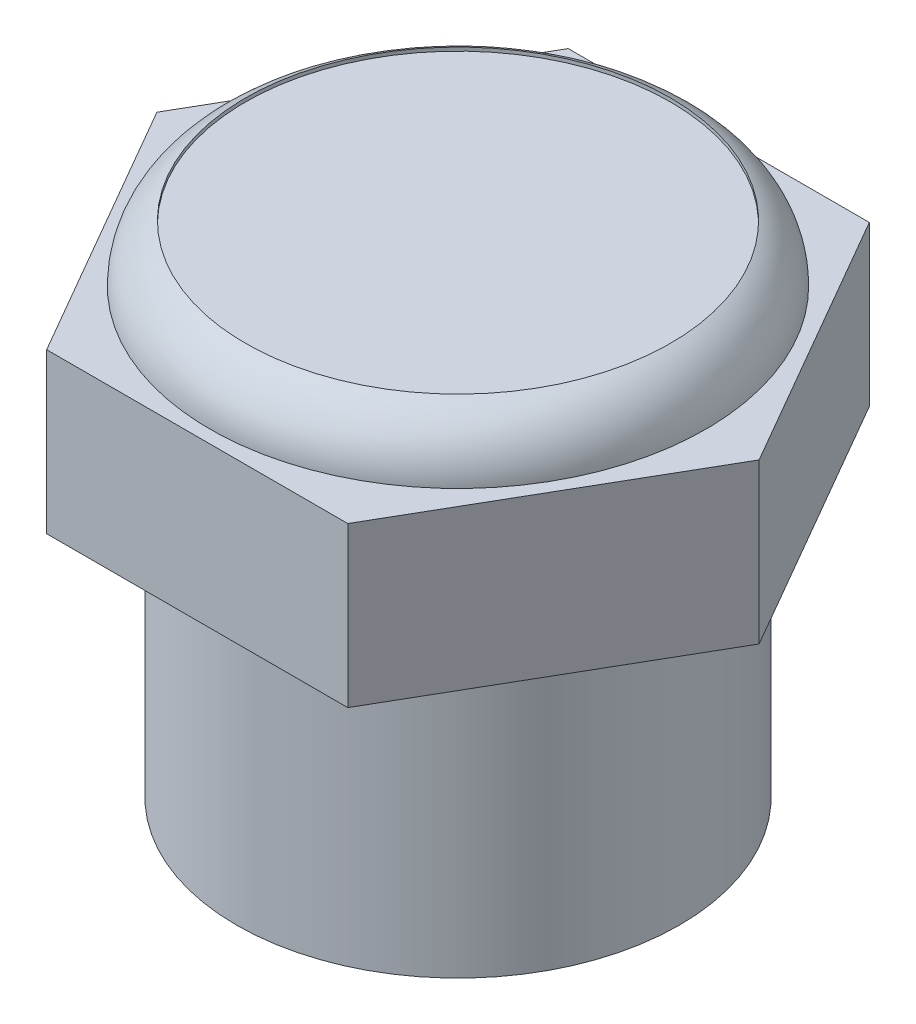
from build123d import *

# Parameters (mm, degrees)
SKETCH_1_R      = 6.25
SKETCH_1_R_2    = 4.5
EXTRUDE_1_DEPTH = 8
EXTRUDE_2_DEPTH = 4.5


with BuildPart() as part:
    # 草图1 → 凸台-拉伸1 (new body)
    with BuildSketch(Plane(origin=(0, 0, 0), x_dir=(1, 0, 0), z_dir=(0, 1, 0))):
        with Locations(Location((0, 0, 0), (0, 0, 270))):
            Circle(SKETCH_1_R)
        with Locations(Location((0, 0, 0), (0, 0, 270))):
            Circle(SKETCH_1_R_2, mode=Mode.SUBTRACT)
    extrude(amount=EXTRUDE_1_DEPTH)

    # 草图2 → 凸台-拉伸2 (add)
    with BuildSketch(Plane(origin=(0, 8, 0), x_dir=(1, 0, 0), z_dir=(0, 1, 0))):
        Polygon((4.25, 7.361215932), (-4.25, 7.361215932), (-8.5, 0), (-4.25, -7.361215932), (4.25, -7.361215932), (8.5, 0), align=None)
    extrude(amount=EXTRUDE_2_DEPTH)

    # 草图3 → 旋转1 (revolve)
    with BuildSketch(Plane.XY, mode=Mode.PRIVATE) as revolve_1_sk:
        with BuildLine():
            ThreePointArc((6, 14.1), (6.729436981, 13.443398113), (7, 12.5))
            Line((7, 12.5), (0, 12.5))
            Line((0, 12.5), (0, 14))
            Line((0, 14), (6, 14))
            Line((6, 14), (6, 14.1))
        make_face()
    revolve(revolve_1_sk.sketch.rotate(Axis((0, -20.81110882, 0), (0, 1, 0)), 90), axis=Axis((0, -20.81110882, 0), (0, 1, 0)))


solid = part.part
